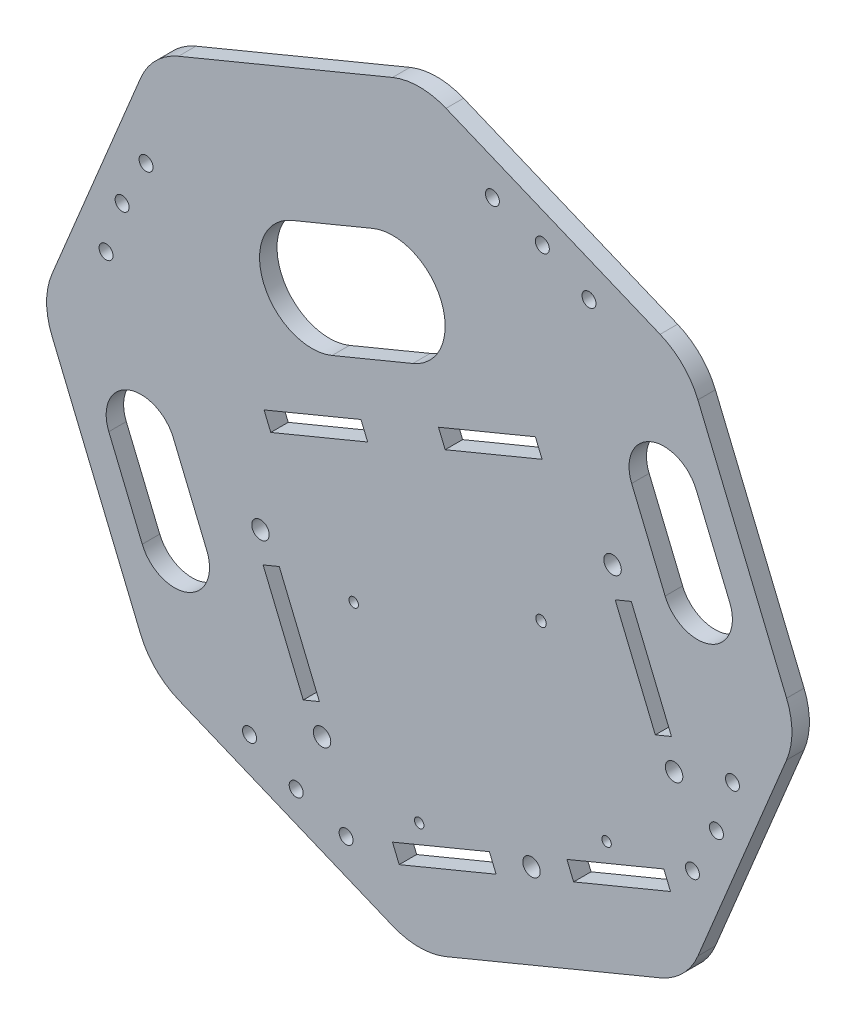
from build123d import *

# Parameters (mm, degrees)
SKETCH_1_R      = 2
SKETCH_1_R_2    = 2.5
SKETCH_1_R_3    = 1.35
SKETCH_1_R_4    = 1.5
EXTRUDE_1_DEPTH = 5
FILLET_1_R      = 20


with BuildPart() as part:
    # 草图1 → 凸台-拉伸1 (new body)
    with BuildSketch(Plane.XY):
        Polygon((0, 108.239220029), (-76.536686473, 76.536686473), (-108.239220029, 0), (-76.536686473, -76.536686473), (0, -108.239220029), (76.536686473, -76.536686473), (108.239220029, 0), (76.536686473, 76.536686473), align=None)
        with Locations((-35.206875778, -84.996916991)):
            Circle(SKETCH_1_R, mode=Mode.SUBTRACT)
        with Locations((84.996916991, -35.206875778)):
            Circle(SKETCH_1_R, mode=Mode.SUBTRACT)
        with Locations((35.206875778, 84.996916991)):
            Circle(SKETCH_1_R, mode=Mode.SUBTRACT)
        with Locations((-84.996916991, 35.206875778)):
            Circle(SKETCH_1_R, mode=Mode.SUBTRACT)
        with Locations((-45.41571145, -25.847352929)):
            Circle(SKETCH_1_R_2, mode=Mode.SUBTRACT)
        with Locations((-27.812273562, -68.345811425)):
            Circle(SKETCH_1_R_2, mode=Mode.SUBTRACT)
        with Locations((55.287157593, 15.865141198)):
            Circle(SKETCH_1_R_2, mode=Mode.SUBTRACT)
        with Locations((72.890595482, -26.633317297)):
            Circle(SKETCH_1_R_2, mode=Mode.SUBTRACT)
        with Locations((32.106246769, -70.586552674)):
            Circle(SKETCH_1_R_2, mode=Mode.SUBTRACT)
        with Locations((-18.756154363, -30.499289721)):
            Circle(SKETCH_1_R_3, mode=Mode.SUBTRACT)
        with Locations((-0.004666177, -75.769386814)):
            Circle(SKETCH_1_R_3, mode=Mode.SUBTRACT)
        with Locations((34.828858522, -8.303650644)):
            Circle(SKETCH_1_R_4, mode=Mode.SUBTRACT)
        with Locations((53.580346708, -53.573747737)):
            Circle(SKETCH_1_R_3, mode=Mode.SUBTRACT)
        with Locations((89.588318422, -20.926853617)):
            Circle(SKETCH_1_R, mode=Mode.SUBTRACT)
        with Locations((-20.926853617, -89.588318422)):
            Circle(SKETCH_1_R, mode=Mode.SUBTRACT)
        with Locations((-89.588318422, 20.926853617)):
            Circle(SKETCH_1_R, mode=Mode.SUBTRACT)
        with Locations((20.926853617, 89.588318422)):
            Circle(SKETCH_1_R, mode=Mode.SUBTRACT)
        with Locations((-48.55098737, -78.146027573)):
            Circle(SKETCH_1_R, mode=Mode.SUBTRACT)
        with Locations((-78.146027573, 48.55098737)):
            Circle(SKETCH_1_R, mode=Mode.SUBTRACT)
        with Locations((48.55098737, 78.146027573)):
            Circle(SKETCH_1_R, mode=Mode.SUBTRACT)
        with Locations((78.146027573, -48.55098737)):
            Circle(SKETCH_1_R, mode=Mode.SUBTRACT)
        Polygon((-40.04454516, -32.281680609), (-28.564042189, -59.998066584), (-33.183439852, -61.911483746), (-44.663942823, -34.19509777), align=None, mode=Mode.SUBTRACT)
        Polygon((-7.653402177, -84.349558002), (20.062983798, -72.869055031), (21.97640096, -77.488452694), (-5.739985015, -88.968955664), align=None, mode=Mode.SUBTRACT)
        Polygon((56.038926221, 7.517396357), (67.519429192, -20.198989618), (72.138826855, -18.285572456), (60.658323884, 9.430813519), align=None, mode=Mode.SUBTRACT)
        Polygon((-42.477594522, -0.276520543), (-14.761208547, 11.203982428), (-16.674625709, 15.82338009), (-44.391011684, 4.342877119), align=None, mode=Mode.SUBTRACT)
        Polygon((42.236092579, -63.684652654), (69.952478554, -52.204149683), (71.865895716, -56.823547346), (44.14950974, -68.304050317), align=None, mode=Mode.SUBTRACT)
        Polygon((7.411900233, 20.388384804), (35.128286209, 31.868887775), (33.214869047, 36.488285438), (5.498483072, 25.007782467), align=None, mode=Mode.SUBTRACT)
        with BuildLine():
            Line((-36.42291726, 55.268626709), (-13.325928947, 64.835712518))
            ThreePointArc((-13.325928947, 64.835712518), (6.272515526, 56.717771016), (-1.845425976, 37.119326542))
            Line((-1.845425976, 37.119326542), (-24.942414289, 27.552240733))
            ThreePointArc((-24.942414289, 27.552240733), (-44.540858762, 35.670182236), (-36.42291726, 55.268626709))
        make_face(mode=Mode.SUBTRACT)
        with BuildLine():
            Line((-70.32577989, -15.599989311), (-60.75869408, -38.696977624))
            ThreePointArc((-60.75869408, -38.696977624), (-66.170655082, -51.762607273), (-79.236284731, -46.350646271))
            Line((-79.236284731, -46.350646271), (-88.80337054, -23.253657958))
            ThreePointArc((-88.80337054, -23.253657958), (-83.391409538, -10.18802831), (-70.32577989, -15.599989311))
        make_face(mode=Mode.SUBTRACT)
        with BuildLine():
            Line((60.75869408, 38.696977624), (70.32577989, 15.599989311))
            ThreePointArc((70.32577989, 15.599989311), (83.391409538, 10.18802831), (88.80337054, 23.253657958))
            Line((88.80337054, 23.253657958), (79.236284731, 46.350646271))
            ThreePointArc((79.236284731, 46.350646271), (66.170655082, 51.762607273), (60.75869408, 38.696977624))
        make_face(mode=Mode.SUBTRACT)
    extrude(amount=EXTRUDE_1_DEPTH)

    # 圆角1
    fillet_1_edges = [part.edges().sort_by_distance(p)[0] for p in [
        (76.536686473, 76.536686473, 2.5),
        (108.239220029, 0, 2.5),
        (76.536686473, -76.536686473, 2.5),
        (0, -108.239220029, 2.5),
        (-76.536686473, -76.536686473, 2.5),
        (-108.239220029, 0, 2.5),
        (-76.536686473, 76.536686473, 2.5),
        (0, 108.239220029, 2.5),
    ]]
    fillet(fillet_1_edges, radius=FILLET_1_R)


solid = part.part
